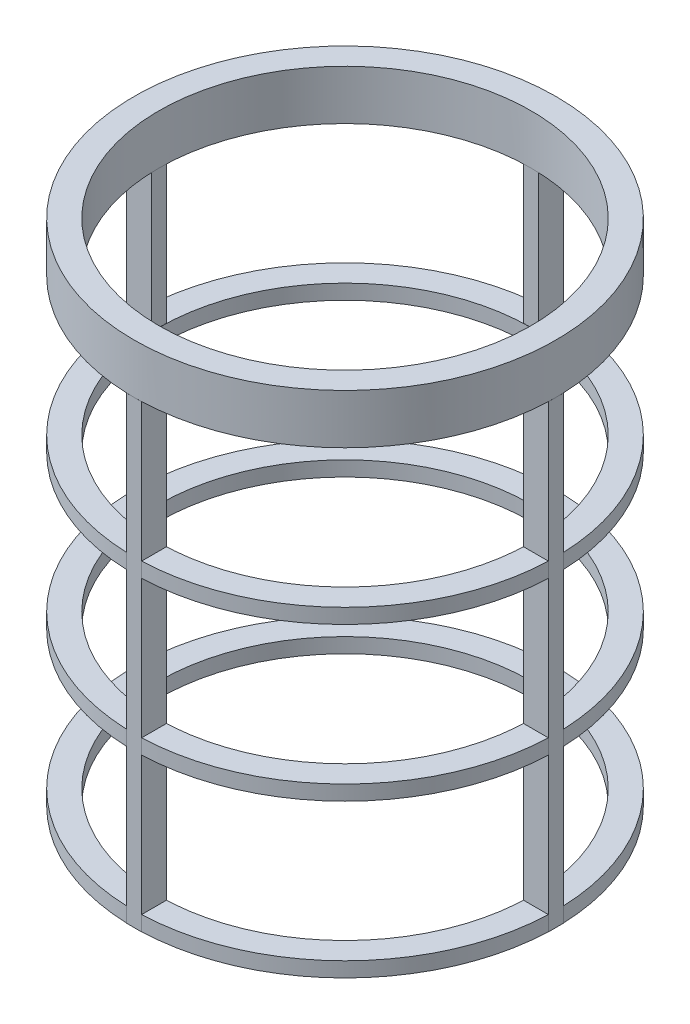
from build123d import *

# Parameters (mm, degrees)
SKETCH1_W           = 6.35
SKETCH1_H           = 12.7
BOSS_EXTRUDE1_DEPTH = 1.905
CIRPATTERN1_COUNT   = 2
CIRPATTERN1_ANGLE   = 90
SKETCH2_R           = 53.975
SKETCH2_R_2         = 47.625
BOSS_EXTRUDE2_DEPTH = 3.81
LPATTERN1_COUNT     = 3
LPATTERN1_PITCH     = 39.15833418
SKETCH4_R           = 60.96
CUT_EXTRUDE1_DEPTH  = 66.04


with BuildPart() as part:
    # Sketch1 → Revolve6 (revolve)
    with BuildSketch(Plane(origin=(0, 0, 0), x_dir=(0, 0, -1), z_dir=(1, 0, 0))):
        with Locations((3.175, -6.35)):
            Rectangle(SKETCH1_W, SKETCH1_H)
    revolve(axis=Axis((0, -130.175, -53.975), (0, -1, 0)))

    # Sketch1<6> → Boss-Extrude1 (add, symmetric)
    with BuildSketch(Plane(origin=(0, 0, 0), x_dir=(0, 0, -1), z_dir=(1, 0, 0))):
        with BuildLine():
            Line((6.35, -12.7), (0, -12.7))
            Line((0, -12.7), (0, -130.175))
            ThreePointArc((0, -130.175), (53.975, -184.15), (107.95, -130.175))
            Line((107.95, -130.175), (107.95, -12.7))
            Line((107.95, -12.7), (101.6, -12.7))
            Line((101.6, -12.7), (101.6, -130.175))
            ThreePointArc((101.6, -130.175), (53.975, -177.8), (6.35, -130.175))
            Line((6.35, -130.175), (6.35, -12.7))
        make_face()
    boss_extrude1 = extrude(amount=BOSS_EXTRUDE1_DEPTH, both=True)

    # CirPattern1: Boss-Extrude1 ×2 about axis
    cirpattern1_axis = Axis((0, -130.175, -53.975), (0, -1, 0))
    for i in range(1, CIRPATTERN1_COUNT):
        add(boss_extrude1.rotate(cirpattern1_axis, i * CIRPATTERN1_ANGLE / (CIRPATTERN1_COUNT - 1)))

    # Sketch2 → Boss-Extrude2 (add)
    with BuildSketch(Plane(origin=(0, -130.175, 0), x_dir=(-1, 0, 0), z_dir=(0, -1, 0))):
        with Locations((0, 53.975)):
            Circle(SKETCH2_R)
        with Locations((0, 53.975)):
            Circle(SKETCH2_R_2, mode=Mode.SUBTRACT)
    boss_extrude2 = extrude(amount=-BOSS_EXTRUDE2_DEPTH)

    # LPattern1: Boss-Extrude2 ×3
    with Locations(*[(0, i * LPATTERN1_PITCH, 0) for i in range(1, LPATTERN1_COUNT)]):
        add(boss_extrude2)

    # Sketch4 → Cut-Extrude1 (cut)
    with BuildSketch(Plane.XZ.offset(130.175)):
        with Locations((0, -53.975)):
            Circle(SKETCH4_R)
    extrude(amount=CUT_EXTRUDE1_DEPTH, mode=Mode.SUBTRACT)


solid = part.part
